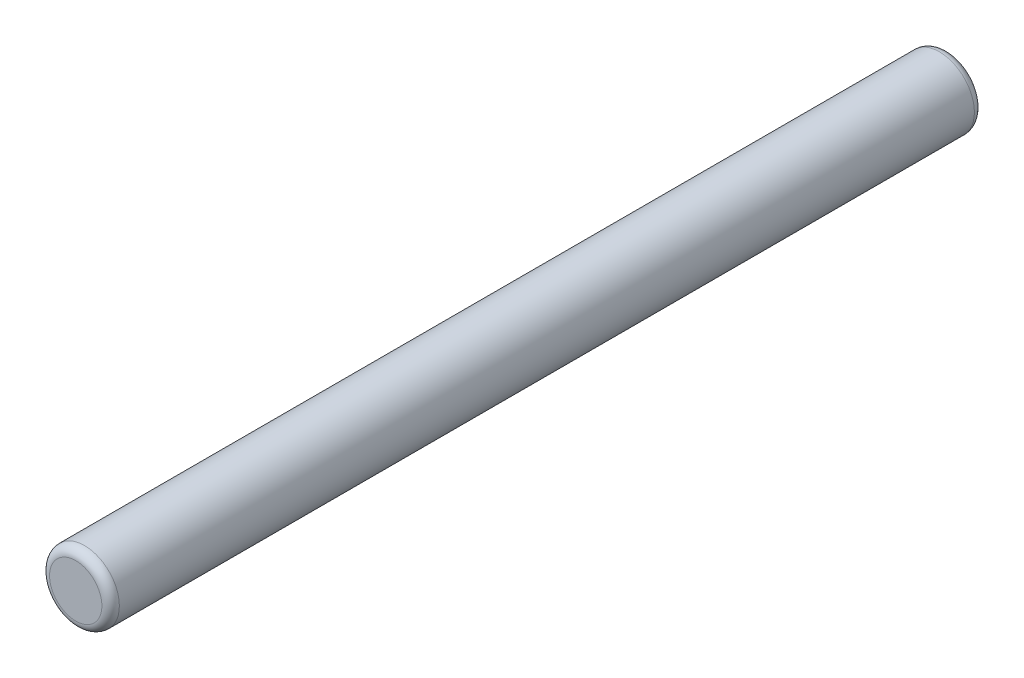
from build123d import *

# Parameters (mm, degrees)
SKETCH1_R           = 4
BOSS_EXTRUDE1_DEPTH = 100
FILLET1_R           = 1


with BuildPart() as part:
    # Sketch1 → Boss-Extrude1 (new body)
    with BuildSketch(Plane.XY):
        Circle(SKETCH1_R)
    extrude(amount=BOSS_EXTRUDE1_DEPTH)

    # Fillet1
    fillet1_edges = [part.edges().sort_by_distance(p)[0] for p in [
        (-4, 0, 0),
        (-4, 0, 100),
    ]]
    fillet(fillet1_edges, radius=FILLET1_R)


solid = part.part
